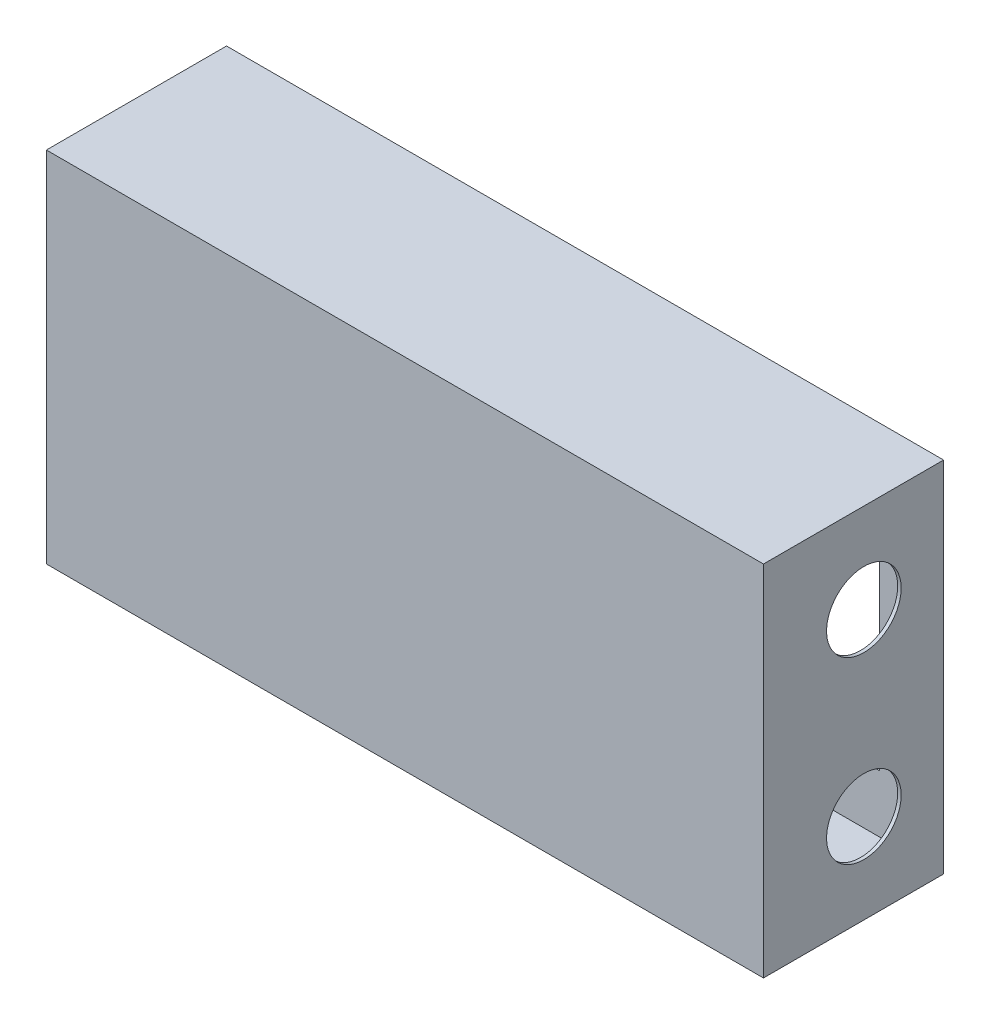
from build123d import *

# Parameters (mm, degrees)
SKETCH_1_W          = 250
SKETCH_1_H          = 125
EXTRUDE_1_DEPTH     = 74.8
SKETCH_2_W          = 250
SKETCH_2_H          = 125
SKETCH_2_W_2        = 210
SKETCH_2_H_2        = 85
CUT_EXTRUDE_1_DEPTH = 12
SKETCH_3_W          = 210
SKETCH_3_H          = 85
EXTRUDE_2_DEPTH     = 4
EXTRUDE_2_DRAFT     = 45
SHELL_1_T           = -1.2
CUT_EXTRUDE_3_REACH = 270.331
SKETCH_12_R         = 13
SKETCH_13_R         = 13
CUT_EXTRUDE_4_DEPTH = 94
SKETCH_14_W         = 230
SKETCH_14_H         = 85
EXTRUDE_3_DEPTH     = 15
SHELL_2_T           = -1.2


with BuildPart() as part:
    # 草图1 → 凸台-拉伸1 (new body)
    with BuildSketch(Plane.XY):
        Rectangle(SKETCH_1_W, SKETCH_1_H)
    extrude(amount=EXTRUDE_1_DEPTH)

    # 草图2 → 切除-拉伸1 (cut)
    with BuildSketch(Plane.XY):
        Rectangle(SKETCH_2_W, SKETCH_2_H)
        Rectangle(SKETCH_2_W_2, SKETCH_2_H_2, mode=Mode.SUBTRACT)
    extrude(amount=CUT_EXTRUDE_1_DEPTH, mode=Mode.SUBTRACT)


with BuildPart() as extrude_2_tool:
    # 草图3 → 凸台-拉伸2 (with draft: the straight prism first)
    with BuildSketch(Plane.XY):
        Rectangle(SKETCH_3_W, SKETCH_3_H)
    extrude(amount=-EXTRUDE_2_DEPTH)
    # 凸台-拉伸2: the draft: its side faces are tilted about the plane it starts from
    extrude_2_sides = [extrude_2_tool.faces().sort_by_distance(p)[0] for p in [
        (0, 42.5, -2),
        (-105, 0, -2),
        (0, -42.5, -2),
        (105, 0, -2),
    ]]
    draft(extrude_2_sides, Plane.XY, EXTRUDE_2_DRAFT)


with BuildPart() as part_1:
    add(part.part)

    # 凸台-拉伸2: add extrude_2_tool
    add(extrude_2_tool.part)

    # 抽壳1
    shell_1_openings = [part_1.faces().sort_by_distance(p)[0] for p in [
        (0, 0, -4),
    ]]
    offset(amount=SHELL_1_T, openings=shell_1_openings, kind=Kind.INTERSECTION)

    # 草图12 → 切除-拉伸3 (cut, up to next)
    with BuildSketch(Plane.ZY.offset(125), mode=Mode.PRIVATE) as cut_extrude_3_sk1:
        with Locations((39.8, 0)):
            Circle(SKETCH_12_R)
    cut_extrude_3_tool1 = extrude(cut_extrude_3_sk1.sketch, amount=-CUT_EXTRUDE_3_REACH, mode=Mode.PRIVATE) & part_1.part
    add(cut_extrude_3_tool1.solids().sort_by_distance((-125, 0, 39.8))[0], mode=Mode.SUBTRACT)

    # 草图13 → 切除-拉伸4 (cut)
    with BuildSketch(Plane(origin=(125, 0, 0), x_dir=(0, 0, -1), z_dir=(1, 0, 0))):
        with Locations((-39.8, 31.25)):
            Circle(SKETCH_13_R)
        with Locations((-39.8, -31.25)):
            Circle(SKETCH_13_R)
    extrude(amount=-CUT_EXTRUDE_4_DEPTH, mode=Mode.SUBTRACT)


with BuildPart() as body_2:
    # 草图14 → 凸台-拉伸3 (new body)
    with BuildSketch(Plane(origin=(0, 0, 73.6), x_dir=(-1, 0, 0), z_dir=(0, 0, -1))):
        with Locations((400, 0)):
            Rectangle(SKETCH_14_W, SKETCH_14_H)
    extrude(amount=EXTRUDE_3_DEPTH)

    # 抽壳2
    shell_2_openings = [body_2.faces().sort_by_distance(p)[0] for p in [
        (-400, 0, 73.6),
    ]]
    offset(amount=SHELL_2_T, openings=shell_2_openings, kind=Kind.INTERSECTION)


with BuildPart() as body_2_1:
    # Move Body 1: moved
    add(body_2.part.moved(Location((400, 0, 0))))


solid = Compound([part_1.part, body_2_1.part])
